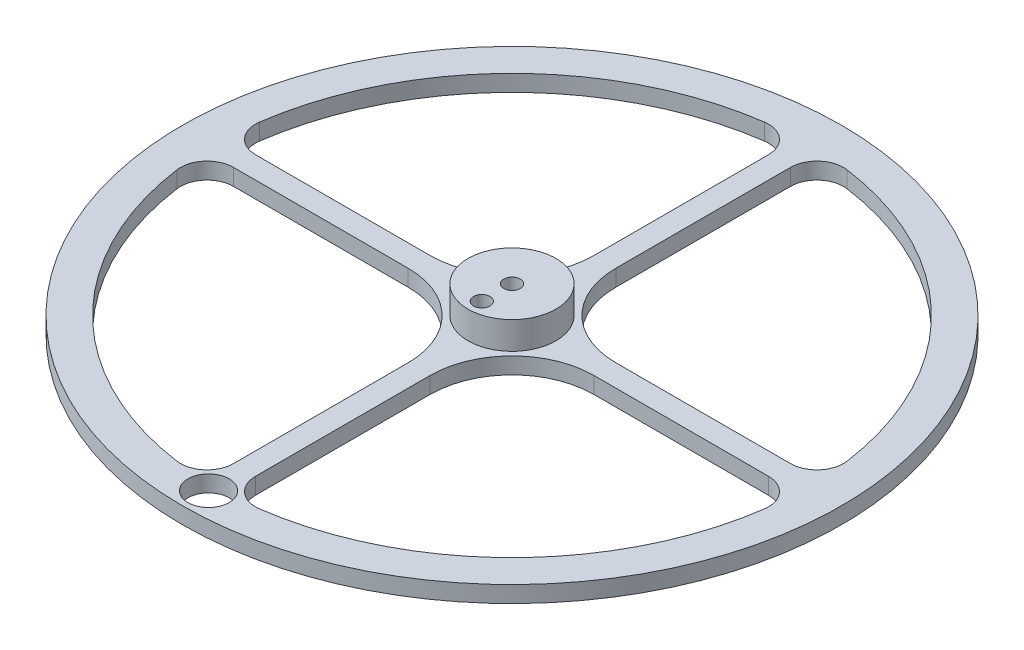
from build123d import *

# Parameters (mm, degrees)
SKETCH1_R           = 60
BOSS_EXTRUDE1_DEPTH = 3
SKETCH1_3_R         = 8
BOSS_EXTRUDE2_DEPTH = 5
CUT_EXTRUDE1_REACH  = 87.229
SKETCH2_R           = 1.5
CUT_EXTRUDE2_REACH  = 87
SKETCH3_R           = 3.75
SKETCH4_R           = 1.5
CUT_EXTRUDE3_DEPTH  = 5


with BuildPart() as part:
    # Sketch1 → Boss-Extrude1 (new body)
    with BuildSketch(Plane(origin=(0, 0, 0), x_dir=(1, 0, 0), z_dir=(0, 1, 0))):
        with Locations(Location((0, 0, 0), (0, 0, 270))):
            Circle(SKETCH1_R)
        with BuildLine():
            ThreePointArc((7.5, -53.47663041), (3.660460389, -52.338407931), (2.000000204, -48.694167705))
            Line((2.000000204, -48.694167705), (2.000000204, -16.899494443))
            ThreePointArc((2.000000204, -16.899494443), (6.363961031, -6.363961031), (16.899494443, -2.000000204))
            Line((16.899494443, -2.000000204), (48.694167705, -2.000000204))
            ThreePointArc((48.694167705, -2.000000204), (52.338407931, -3.660460389), (53.47663041, -7.5))
            ThreePointArc((53.47663041, -7.5), (38.183766184, -38.183766184), (7.5, -53.47663041))
        make_face(mode=Mode.SUBTRACT)
        with BuildLine():
            ThreePointArc((53.47663041, 7.5), (52.338407931, 3.660460389), (48.694167705, 2.000000204))
            Line((48.694167705, 2.000000204), (16.899494443, 2.000000204))
            ThreePointArc((16.899494443, 2.000000204), (6.363961031, 6.363961031), (2.000000204, 16.899494443))
            Line((2.000000204, 16.899494443), (2.000000204, 48.694167705))
            ThreePointArc((2.000000204, 48.694167705), (3.660460389, 52.338407931), (7.5, 53.47663041))
            ThreePointArc((7.5, 53.47663041), (38.183766184, 38.183766184), (53.47663041, 7.5))
        make_face(mode=Mode.SUBTRACT)
        with BuildLine():
            ThreePointArc((-7.5, 53.47663041), (-3.660460389, 52.338407931), (-2.000000204, 48.694167705))
            Line((-2.000000204, 48.694167705), (-2.000000204, 16.899494443))
            ThreePointArc((-2.000000204, 16.899494443), (-6.363961031, 6.363961031), (-16.899494443, 2.000000204))
            Line((-16.899494443, 2.000000204), (-48.694167705, 2.000000204))
            ThreePointArc((-48.694167705, 2.000000204), (-52.338407931, 3.660460389), (-53.47663041, 7.5))
            ThreePointArc((-53.47663041, 7.5), (-38.183766184, 38.183766184), (-7.5, 53.47663041))
        make_face(mode=Mode.SUBTRACT)
        with BuildLine():
            ThreePointArc((-53.47663041, -7.5), (-52.338407931, -3.660460389), (-48.694167705, -2.000000204))
            Line((-48.694167705, -2.000000204), (-16.899494443, -2.000000204))
            ThreePointArc((-16.899494443, -2.000000204), (-6.363961031, -6.363961031), (-2.000000204, -16.899494443))
            Line((-2.000000204, -16.899494443), (-2.000000204, -48.694167705))
            ThreePointArc((-2.000000204, -48.694167705), (-3.660460389, -52.338407931), (-7.5, -53.47663041))
            ThreePointArc((-7.5, -53.47663041), (-38.183766184, -38.183766184), (-53.47663041, -7.5))
        make_face(mode=Mode.SUBTRACT)
    extrude(amount=-BOSS_EXTRUDE1_DEPTH)

    # Sketch1<3> → Boss-Extrude2 (add)
    with BuildSketch(Plane(origin=(0, 0, 0), x_dir=(1, 0, 0), z_dir=(0, 1, 0))):
        with Locations(Location((0, 0, 0), (0, 0, 270))):
            Circle(SKETCH1_3_R)
    extrude(amount=BOSS_EXTRUDE2_DEPTH)

    # Sketch2 → Cut-Extrude1 (cut, up to next)
    with BuildSketch(Plane(origin=(0, 5, 0), x_dir=(1, 0, 0), z_dir=(0, 1, 0)), mode=Mode.PRIVATE) as cut_extrude1_sk1:
        with Locations(Location((0, 0, 0), (0, 0, 270))):
            Circle(SKETCH2_R)
    cut_extrude1_tool1 = extrude(cut_extrude1_sk1.sketch, amount=-CUT_EXTRUDE1_REACH, mode=Mode.PRIVATE) & part.part
    add(cut_extrude1_tool1.solids().sort_by_distance((0, 5, 0))[0], mode=Mode.SUBTRACT)

    # Sketch3 → Cut-Extrude2 (cut, up to next)
    with BuildSketch(Plane(origin=(0, 0, 0), x_dir=(1, 0, 0), z_dir=(0, 1, 0)), mode=Mode.PRIVATE) as cut_extrude2_sk1:
        with Locations(Location((0, -55.25, 0), (0, 0, 270))):
            Circle(SKETCH3_R)
    cut_extrude2_tool1 = extrude(cut_extrude2_sk1.sketch, amount=-CUT_EXTRUDE2_REACH, mode=Mode.PRIVATE) & part.part
    add(cut_extrude2_tool1.solids().sort_by_distance((0, 0, 55.25))[0], mode=Mode.SUBTRACT)

    # Sketch4 → Cut-Extrude3 (cut)
    with BuildSketch(Plane(origin=(0, 5, 0), x_dir=(1, 0, 0), z_dir=(0, 1, 0))):
        with Locations(Location((0, -5.5, 0), (0, 0, 270))):
            Circle(SKETCH4_R)
    extrude(amount=-CUT_EXTRUDE3_DEPTH, mode=Mode.SUBTRACT)


solid = part.part
